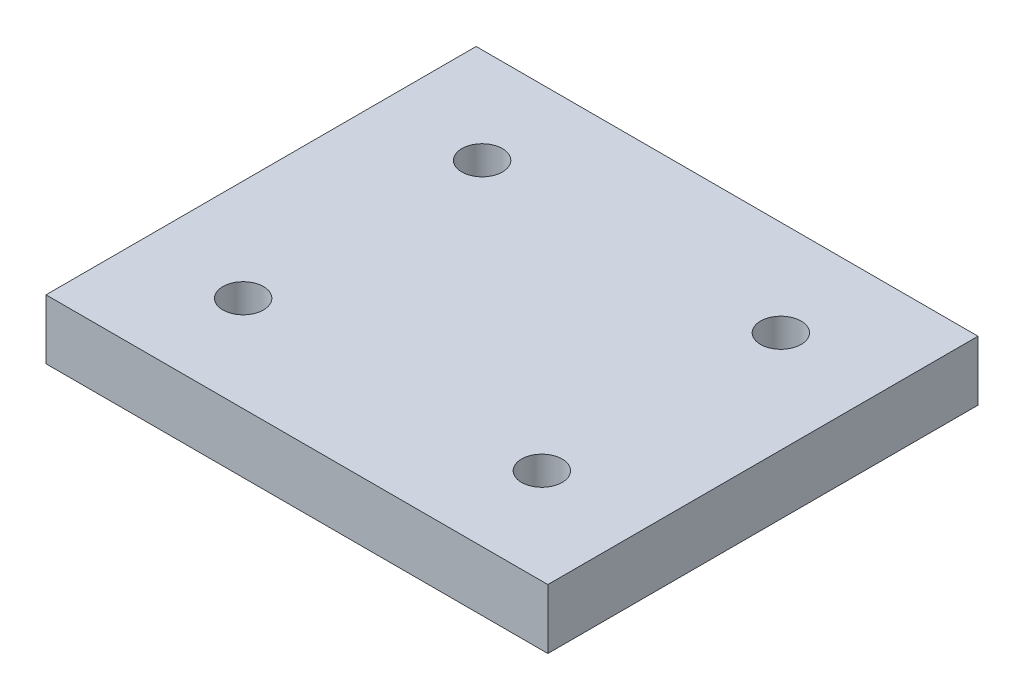
from build123d import *

# Parameters (mm, degrees)
SKETCH_1_W          = 42
SKETCH_1_H          = 36
EXTRUDE_1_DEPTH     = 5
SKETCH_2_R          = 1.7
CUT_EXTRUDE_1_DEPTH = 5


with BuildPart() as part:
    # 스케치1 → 보스-돌출1 (new body)
    with BuildSketch(Plane(origin=(0, 0, 0), x_dir=(1, 0, 0), z_dir=(0, 1, 0))):
        with Locations((21, 18)):
            Rectangle(SKETCH_1_W, SKETCH_1_H)
    extrude(amount=EXTRUDE_1_DEPTH)

    # 스케치2 → 컷-돌출1 (cut)
    with BuildSketch(Plane(origin=(0, 5, 0), x_dir=(1, 0, 0), z_dir=(0, 1, 0))):
        with Locations(Location((33.5, 28, 0), (0, 0, 270))):
            Circle(SKETCH_2_R)
        with Locations(Location((33.5, 8, 0), (0, 0, 270))):
            Circle(SKETCH_2_R)
        with Locations(Location((8.5, 8, 0), (0, 0, 270))):
            Circle(SKETCH_2_R)
        with Locations(Location((8.5, 28, 0), (0, 0, 270))):
            Circle(SKETCH_2_R)
    extrude(amount=-CUT_EXTRUDE_1_DEPTH, mode=Mode.SUBTRACT)


solid = part.part
